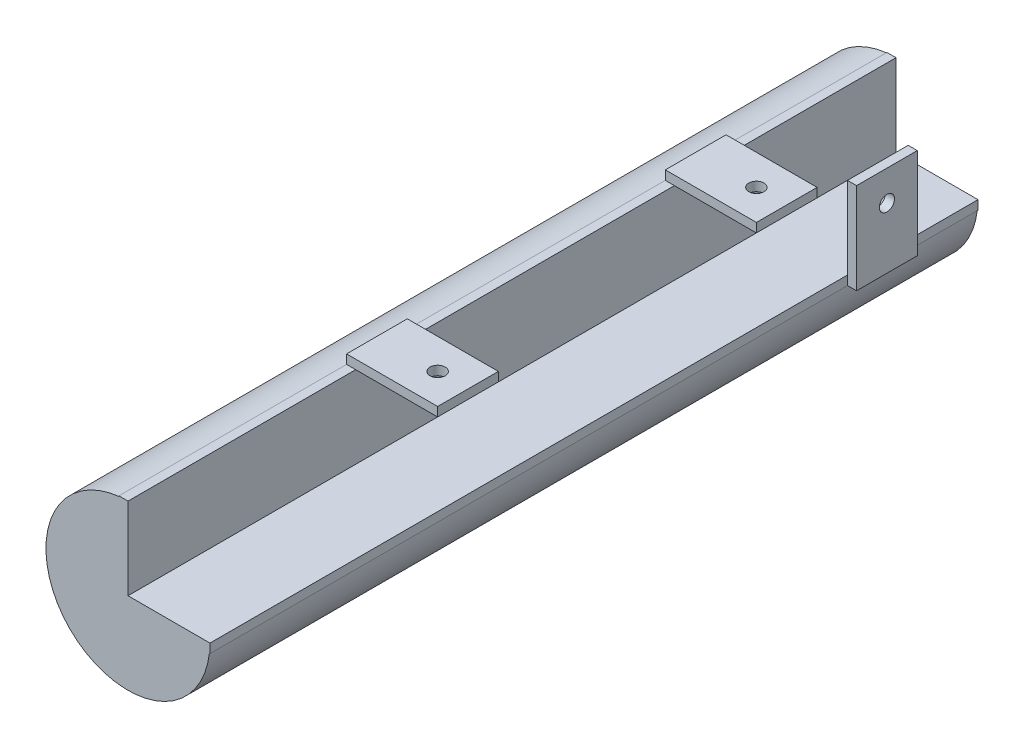
from build123d import *

# Parameters (mm, degrees)
BOSS_EXTRUDE1_DEPTH  = 126.5
SKETCH12_W           = 20
SKETCH12_H           = 30
BOSS_EXTRUDE6_DEPTH  = 3
CUT_EXTRUDE3_REACH   = 143.366
SKETCH13_R           = 2.5
SKETCH17_W           = 30
SKETCH17_H           = 20
BOSS_EXTRUDE10_DEPTH = 3
CUT_EXTRUDE5_REACH   = 143.957
SKETCH18_R           = 2.5


with BuildPart() as part:
    # Sketch4 → Boss-Extrude1 (new, symmetric)
    with BuildSketch(Plane.XY):
        with BuildLine():
            Line((0, 0), (27, 0))
            Line((27, 0), (27, -3))
            Line((27, -3), (26.800082477, -3))
            ThreePointArc((26.800082477, -3), (-19.135504983, -19.08508544), (-3, 26.83281573))
            Line((-3, 26.83281573), (-3, 27))
            Line((-3, 27), (0, 27))
            Line((0, 27), (0, 0))
        make_face()
    extrude(amount=BOSS_EXTRUDE1_DEPTH, both=True)

    # Sketch12 → Boss-Extrude6 (add)
    with BuildSketch(Plane(origin=(27, 0, 0), x_dir=(0, 0, -1), z_dir=(1, 0, 0))):
        with Locations((93.5, 12)):
            Rectangle(SKETCH12_W, SKETCH12_H)
    extrude(amount=BOSS_EXTRUDE6_DEPTH)

    # Sketch13 → Cut-Extrude3 (cut, up to next)
    with BuildSketch(Plane(origin=(30, 0, 0), x_dir=(0, 0, -1), z_dir=(1, 0, 0)), mode=Mode.PRIVATE) as cut_extrude3_sk1:
        with Locations((93.5, 17)):
            Circle(SKETCH13_R)
    cut_extrude3_tool1 = extrude(cut_extrude3_sk1.sketch, amount=-CUT_EXTRUDE3_REACH, mode=Mode.PRIVATE) & part.part
    add(cut_extrude3_tool1.solids().sort_by_distance((30, 17, -93.5))[0], mode=Mode.SUBTRACT)

    # Sketch17 → Boss-Extrude10 (add)
    with BuildSketch(Plane(origin=(0, 27, 0), x_dir=(1, 0, 0), z_dir=(0, 1, 0))):
        with Locations((12, 63.5)):
            Rectangle(SKETCH17_W, SKETCH17_H)
        with Locations((12, -41.5)):
            Rectangle(SKETCH17_W, SKETCH17_H)
    extrude(amount=BOSS_EXTRUDE10_DEPTH)

    # Sketch18 → Cut-Extrude5 (cut, up to next)
    with BuildSketch(Plane(origin=(0, 30, 0), x_dir=(1, 0, 0), z_dir=(0, 1, 0)), mode=Mode.PRIVATE) as cut_extrude5_sk1:
        with Locations(Location((17, 63.5, 0), (0, 0, 270))):
            Circle(SKETCH18_R)
    cut_extrude5_tool1 = extrude(cut_extrude5_sk1.sketch, amount=-CUT_EXTRUDE5_REACH, mode=Mode.PRIVATE) & part.part
    # Sketch18 → Cut-Extrude5 (cut, up to next)
    with BuildSketch(Plane(origin=(0, 30, 0), x_dir=(1, 0, 0), z_dir=(0, 1, 0)), mode=Mode.PRIVATE) as cut_extrude5_sk2:
        with Locations(Location((17, -41.5, 0), (0, 0, 270))):
            Circle(SKETCH18_R)
    cut_extrude5_tool2 = extrude(cut_extrude5_sk2.sketch, amount=-CUT_EXTRUDE5_REACH, mode=Mode.PRIVATE) & part.part
    add(cut_extrude5_tool1.solids().sort_by_distance((17, 30, -63.5))[0], mode=Mode.SUBTRACT)
    add(cut_extrude5_tool2.solids().sort_by_distance((17, 30, 41.5))[0], mode=Mode.SUBTRACT)


solid = part.part
